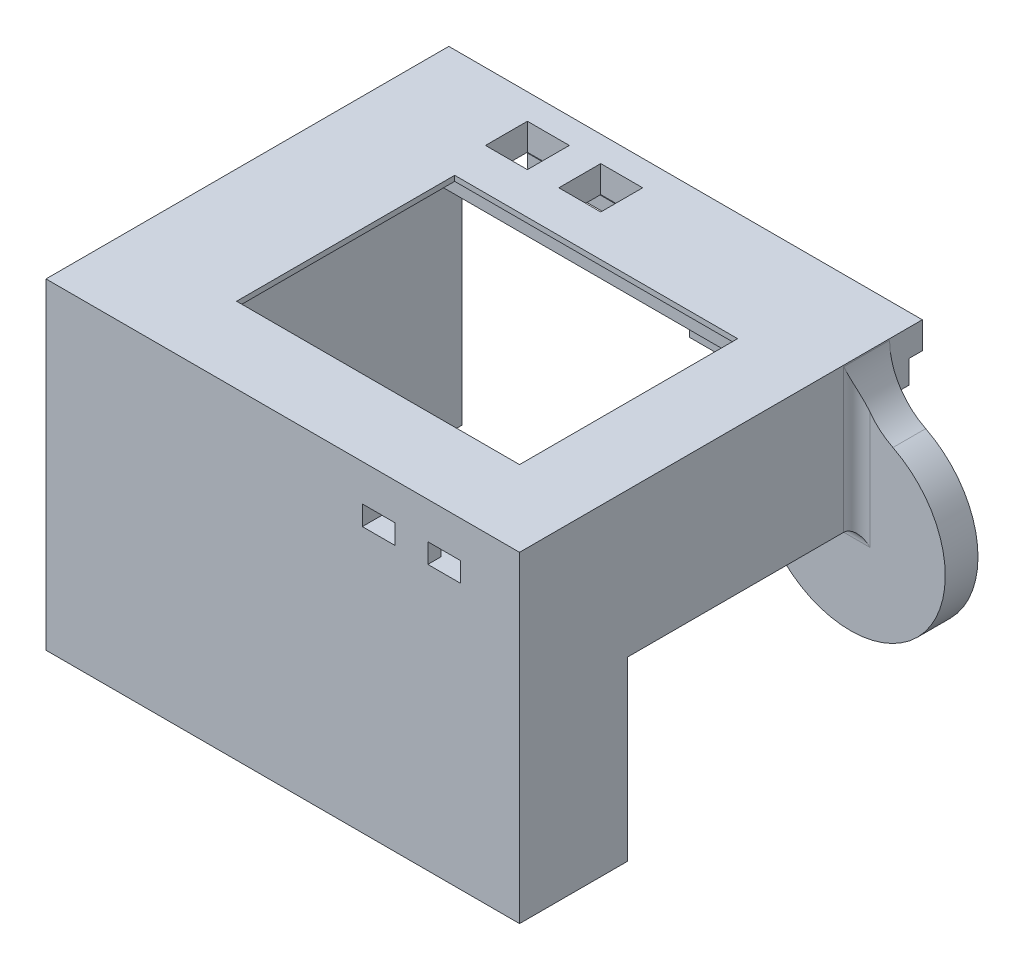
from build123d import *

# Parameters (mm, degrees)
SKETCH1_W            = 72.3
SKETCH1_H            = 56.5
SKETCH1_W_2          = 52.3
SKETCH1_H_2          = 36.5
BOSS_EXTRUDE1_DEPTH  = 3.3
SKETCH2_W            = 72.3
SKETCH2_H            = 2
BOSS_EXTRUDE2_DEPTH  = 45
SKETCH3_W            = 2
SKETCH3_H            = 45
BOSS_EXTRUDE3_DEPTH  = 54.5
SKETCH5_W            = 72.3
SKETCH5_H            = 56.5
SKETCH5_W_2          = 43.2
SKETCH5_H_2          = 33.3
BOSS_EXTRUDE6_DEPTH  = 0.8
SKETCH6_W            = 68.3
SKETCH6_H            = 1.5
BOSS_EXTRUDE7_DEPTH  = 7.8
BOSS_EXTRUDE8_DEPTH  = 7.8
SKETCH8_W            = 18.0427139
SKETCH8_H            = 6
SKETCH8_W_2          = 15
SKETCH8_H_2          = 3
BOSS_EXTRUDE9_DEPTH  = 10
SKETCH9_W            = 4
SKETCH9_H            = 26.5
CUT_EXTRUDE1_DEPTH   = 2
SKETCH10_W           = 2
SKETCH10_H           = 30
CUT_EXTRUDE2_DEPTH   = 40
SKETCH11_W           = 2
SKETCH11_H           = 1
BOSS_EXTRUDE10_DEPTH = 20
SKETCH13_W           = 15
SKETCH13_H           = 3
BOSS_EXTRUDE11_DEPTH = 5
SKETCH12_W           = 6.2
SKETCH12_H           = 6.2
CUT_EXTRUDE3_DEPTH   = 10
SKETCH14_W           = 18.0427139
SKETCH14_H           = 5
CUT_EXTRUDE4_DEPTH   = 25
SKETCH15_W           = 29.613072231
SKETCH15_H           = 15.101269166
CUT_EXTRUDE5_DEPTH   = 2
SKETCH17_W           = 5.5
SKETCH17_H           = 8
BOSS_EXTRUDE12_DEPTH = 6
SKETCH20_W           = 2
SKETCH20_H           = 3
BOSS_EXTRUDE14_DEPTH = 43
SKETCH21_R           = 14.5
BOSS_EXTRUDE15_DEPTH = 8
SKETCH22_R           = 12.75
CUT_EXTRUDE6_DEPTH   = 6
FILLET1_R            = 2
SKETCH23_W           = 17.408302374
SKETCH23_H           = 1
BOSS_EXTRUDE16_DEPTH = 2
BOSS_EXTRUDE17_REACH = 131.062
SKETCH24_W           = 1.408302374
SKETCH24_H           = 2
SKETCH24_W_2         = 1.408302375
SKETCH25_W           = 17.4
SKETCH25_H           = 2
BOSS_EXTRUDE18_DEPTH = 2
SKETCH26_W           = 6.4
SKETCH26_H           = 6.4
CUT_EXTRUDE7_DEPTH   = 4.1
SKETCH28_W           = 5
SKETCH28_H           = 3
CUT_EXTRUDE9_DEPTH   = 2
SKETCH29_R           = 14.5
SKETCH29_R_2         = 12.75
CUT_EXTRUDE10_DEPTH  = 3
FILLET2_R            = 10


with BuildPart() as part:
    # Sketch1 → Boss-Extrude1 (new body)
    with BuildSketch(Plane(origin=(0, 0, 0), x_dir=(1, 0, 0), z_dir=(0, 1, 0))):
        with Locations((59.895731411, 31.047033621)):
            Rectangle(SKETCH1_W, SKETCH1_H)
        with Locations((59.895731411, 31.047033621)):
            Rectangle(SKETCH1_W_2, SKETCH1_H_2, mode=Mode.SUBTRACT)
    extrude(amount=BOSS_EXTRUDE1_DEPTH)

    # Sketch2 → Boss-Extrude2 (add)
    with BuildSketch(Plane.XZ):
        with Locations((59.895731411, -3.797033621)):
            Rectangle(SKETCH2_W, SKETCH2_H)
    extrude(amount=BOSS_EXTRUDE2_DEPTH)

    # Sketch3 → Boss-Extrude3 (add)
    with BuildSketch(Plane(origin=(0, 0, -4.797033621), x_dir=(-1, 0, 0), z_dir=(0, 0, -1))):
        with Locations((-95.045731411, -22.5)):
            Rectangle(SKETCH3_W, SKETCH3_H)
        with Locations((-24.745731411, -22.5)):
            Rectangle(SKETCH3_W, SKETCH3_H)
    extrude(amount=BOSS_EXTRUDE3_DEPTH)

    # Sketch5 → Boss-Extrude6 (add)
    with BuildSketch(Plane(origin=(0, 3.3, 0), x_dir=(1, 0, 0), z_dir=(0, 1, 0))):
        with Locations((59.895731411, 31.047033621)):
            Rectangle(SKETCH5_W, SKETCH5_H)
        with Locations((62.845731411, 31.047033621)):
            Rectangle(SKETCH5_W_2, SKETCH5_H_2, mode=Mode.SUBTRACT)
    extrude(amount=BOSS_EXTRUDE6_DEPTH)

    # Sketch6 → Boss-Extrude7 (add)
    with BuildSketch(Plane(origin=(0, 0, -4.797033621), x_dir=(-1, 0, 0), z_dir=(0, 0, -1))):
        with Locations((-59.895731411, -0.75)):
            Rectangle(SKETCH6_W, SKETCH6_H)
    extrude(amount=BOSS_EXTRUDE7_DEPTH)

    # Sketch7 → Boss-Extrude8 (add)
    with BuildSketch(Plane(origin=(0, 0, -4.797033621), x_dir=(-1, 0, 0), z_dir=(0, 0, -1))):
        Polygon((-87.045731411, -1.5), (-87.045731411, -4.5), (-72.045731411, -4.5), (-72.045731411, -1.5), (-70.545731411, -1.5), (-70.545731411, -6), (-88.545731411, -6), (-88.545731411, -1.5), align=None)
    extrude(amount=BOSS_EXTRUDE8_DEPTH)

    # Sketch8 → Boss-Extrude9 (add)
    with BuildSketch(Plane(origin=(0, 0, -59.297033621), x_dir=(-1, 0, 0), z_dir=(0, 0, -1))):
        with Locations((-79.524374461, -3)):
            Rectangle(SKETCH8_W, SKETCH8_H)
        with Locations((-79.545731411, -3)):
            Rectangle(SKETCH8_W_2, SKETCH8_H_2, mode=Mode.SUBTRACT)
    extrude(amount=-BOSS_EXTRUDE9_DEPTH)

    # Sketch9 → Cut-Extrude1 (cut)
    with BuildSketch(Plane.XZ):
        with Locations((88.045731411, -31.047033621)):
            Rectangle(SKETCH9_W, SKETCH9_H)
    extrude(amount=-CUT_EXTRUDE1_DEPTH, mode=Mode.SUBTRACT)

    # Sketch10 → Cut-Extrude2 (cut)
    with BuildSketch(Plane(origin=(0, 0, -59.297033621), x_dir=(-1, 0, 0), z_dir=(0, 0, -1))):
        with Locations((-95.045731411, -30)):
            Rectangle(SKETCH10_W, SKETCH10_H)
    extrude(amount=-CUT_EXTRUDE2_DEPTH, mode=Mode.SUBTRACT)

    # Sketch11 → Boss-Extrude10 (add)
    with BuildSketch(Plane.XZ.offset(1.5)):
        with Locations((93.045731411, -7.697033621)):
            Rectangle(SKETCH11_W, SKETCH11_H)
        with Locations((26.745731411, -7.697033621)):
            Rectangle(SKETCH11_W, SKETCH11_H)
    extrude(amount=BOSS_EXTRUDE10_DEPTH)

    # Sketch13 → Boss-Extrude11 (add)
    with BuildSketch(Plane(origin=(0, 0, -59.297033621), x_dir=(-1, 0, 0), z_dir=(0, 0, -1))):
        Polygon((-96.045731411, 4.1), (-96.045731411, -15), (-94.045731411, -15), (-94.045731411, 0), (-88.545731411, 0), (-88.545731411, -6), (-70.503017511, -6), (-70.503017511, 0), (-25.745731411, 0), (-25.745731411, -45), (-23.745731411, -45), (-23.745731411, 4.1), align=None)
        with Locations((-79.545731411, -3)):
            Rectangle(SKETCH13_W, SKETCH13_H, mode=Mode.SUBTRACT)
    extrude(amount=BOSS_EXTRUDE11_DEPTH)

    # Sketch12 → Cut-Extrude3 (cut)
    with BuildSketch(Plane(origin=(0, 4.1, 0), x_dir=(1, 0, 0), z_dir=(0, 1, 0))):
        with Locations((42.845731411, 57.197033621)):
            Rectangle(SKETCH12_W, SKETCH12_H)
        with Locations((54.045731411, 57.197033621)):
            Rectangle(SKETCH12_W, SKETCH12_H)
    extrude(amount=-CUT_EXTRUDE3_DEPTH, mode=Mode.SUBTRACT)

    # Sketch14 → Cut-Extrude4 (cut)
    with BuildSketch(Plane.XZ):
        with Locations((79.524374461, -51.797033621)):
            Rectangle(SKETCH14_W, SKETCH14_H)
    extrude(amount=CUT_EXTRUDE4_DEPTH, mode=Mode.SUBTRACT)

    # Sketch15 → Cut-Extrude5 (cut)
    with BuildSketch(Plane(origin=(0, 0, -64.297033621), x_dir=(-1, 0, 0), z_dir=(0, 0, -1))):
        with Locations((-85.309553627, -7.550634583)):
            Rectangle(SKETCH15_W, SKETCH15_H)
    extrude(amount=-CUT_EXTRUDE5_DEPTH, mode=Mode.SUBTRACT)

    # Sketch17 → Boss-Extrude12 (add)
    with BuildSketch(Plane.XZ):
        with Locations((91.295731411, -58.297033621)):
            Rectangle(SKETCH17_W, SKETCH17_H)
    extrude(amount=BOSS_EXTRUDE12_DEPTH)

    # Sketch20 → Boss-Extrude14 (add)
    with BuildSketch(Plane(origin=(0, 0, -19.297033621), x_dir=(-1, 0, 0), z_dir=(0, 0, -1))):
        with Locations((-95.045731411, -16.5)):
            Rectangle(SKETCH20_W, SKETCH20_H)
    extrude(amount=BOSS_EXTRUDE14_DEPTH)

    # Sketch21 → Boss-Extrude15 (add)
    with BuildSketch(Plane(origin=(0, 0, -62.297033621), x_dir=(-1, 0, 0), z_dir=(0, 0, -1))):
        with Locations((-95.045731411, -18)):
            Circle(SKETCH21_R)
    extrude(amount=-BOSS_EXTRUDE15_DEPTH)

    # Sketch22 → Cut-Extrude6 (cut)
    with BuildSketch(Plane(origin=(0, 0, -62.297033621), x_dir=(-1, 0, 0), z_dir=(0, 0, -1))):
        with Locations((-95.045731411, -18)):
            Circle(SKETCH22_R)
    extrude(amount=-CUT_EXTRUDE6_DEPTH, mode=Mode.SUBTRACT)

    # Fillet1
    fillet1_edges = [part.edges().sort_by_distance(p)[0] for p in [
        (94.045731411, -9, -54.297033621),
        (95.045731411, -18, -54.297033621),
        (96.045731411, -10.767261929, -54.297033621),
    ]]
    fillet(fillet1_edges, radius=FILLET1_R)

    # Sketch23 → Boss-Extrude16 (add)
    with BuildSketch(Plane.XZ):
        with Locations((48.449882598, -53.597033621)):
            Rectangle(SKETCH23_W, SKETCH23_H)
    extrude(amount=BOSS_EXTRUDE16_DEPTH)

    # Boss-Extrude17: up to this face of the body (flat: up to its plane)
    boss_extrude17_end = Plane(part.part.faces().sort_by_distance((83.274374461, -0.50799444, -62.297033621))[0])
    # Sketch24 → Boss-Extrude17 (add, up to the picked face)
    with BuildSketch(Plane(origin=(0, 0, -54.097033621), x_dir=(-1, 0, 0), z_dir=(0, 0, -1)), mode=Mode.PRIVATE) as boss_extrude17_sk1:
        with Locations((-54.049882598, -1)):
            Rectangle(SKETCH24_W, SKETCH24_H)
    boss_extrude17_tool1 = split(extrude(boss_extrude17_sk1.sketch, amount=BOSS_EXTRUDE17_REACH, mode=Mode.PRIVATE), bisect_by=boss_extrude17_end, keep=Keep.BOTH, mode=Mode.PRIVATE)
    # Sketch24 → Boss-Extrude17 (add, up to the picked face)
    with BuildSketch(Plane(origin=(0, 0, -54.097033621), x_dir=(-1, 0, 0), z_dir=(0, 0, -1)), mode=Mode.PRIVATE) as boss_extrude17_sk2:
        with Locations((-42.841580224, -1)):
            Rectangle(SKETCH24_W_2, SKETCH24_H)
    boss_extrude17_tool2 = split(extrude(boss_extrude17_sk2.sketch, amount=BOSS_EXTRUDE17_REACH, mode=Mode.PRIVATE), bisect_by=boss_extrude17_end, keep=Keep.BOTH, mode=Mode.PRIVATE)
    add(boss_extrude17_tool1.solids().sort_by(Axis((54.049883, -1, -54.097034), (0, 0, -1)))[0])
    add(boss_extrude17_tool2.solids().sort_by(Axis((42.84158, -1, -54.097034), (0, 0, -1)))[0])

    # Sketch25 → Boss-Extrude18 (add)
    with BuildSketch(Plane.XZ):
        with Locations((48.445731411, -61.297033621)):
            Rectangle(SKETCH25_W, SKETCH25_H)
    extrude(amount=BOSS_EXTRUDE18_DEPTH)

    # Sketch26 → Cut-Extrude7 (cut)
    with BuildSketch(Plane(origin=(0, 4.1, 0), x_dir=(1, 0, 0), z_dir=(0, 1, 0))):
        with Locations((42.845731411, 57.197033621)):
            Rectangle(SKETCH26_W, SKETCH26_H)
        with Locations((54.045731411, 57.197033621)):
            Rectangle(SKETCH26_W, SKETCH26_H)
    extrude(amount=-CUT_EXTRUDE7_DEPTH, mode=Mode.SUBTRACT)

    # Sketch28 → Cut-Extrude9 (cut)
    with BuildSketch(Plane(origin=(0, 0, -4.797033621), x_dir=(-1, 0, 0), z_dir=(0, 0, -1))):
        with Locations((-84.545731411, -3)):
            Rectangle(SKETCH28_W, SKETCH28_H)
        with Locations((-74.545731411, -3)):
            Rectangle(SKETCH28_W, SKETCH28_H)
    extrude(amount=-CUT_EXTRUDE9_DEPTH, mode=Mode.SUBTRACT)

    # Sketch29 → Cut-Extrude10 (cut)
    with BuildSketch(Plane(origin=(0, 0, -62.297033621), x_dir=(-1, 0, 0), z_dir=(0, 0, -1))):
        with Locations((-95.045731411, -18)):
            Circle(SKETCH29_R)
        with Locations((-95.045731411, -18)):
            Circle(SKETCH29_R_2, mode=Mode.SUBTRACT)
    extrude(amount=-CUT_EXTRUDE10_DEPTH, mode=Mode.SUBTRACT)

    # Fillet2
    fillet2_edges = [part.edges().sort_by_distance(p)[0] for p in [
        (96.045731411, -3.534523859, -55.797033621),
    ]]
    fillet(fillet2_edges, radius=FILLET2_R)


solid = part.part
